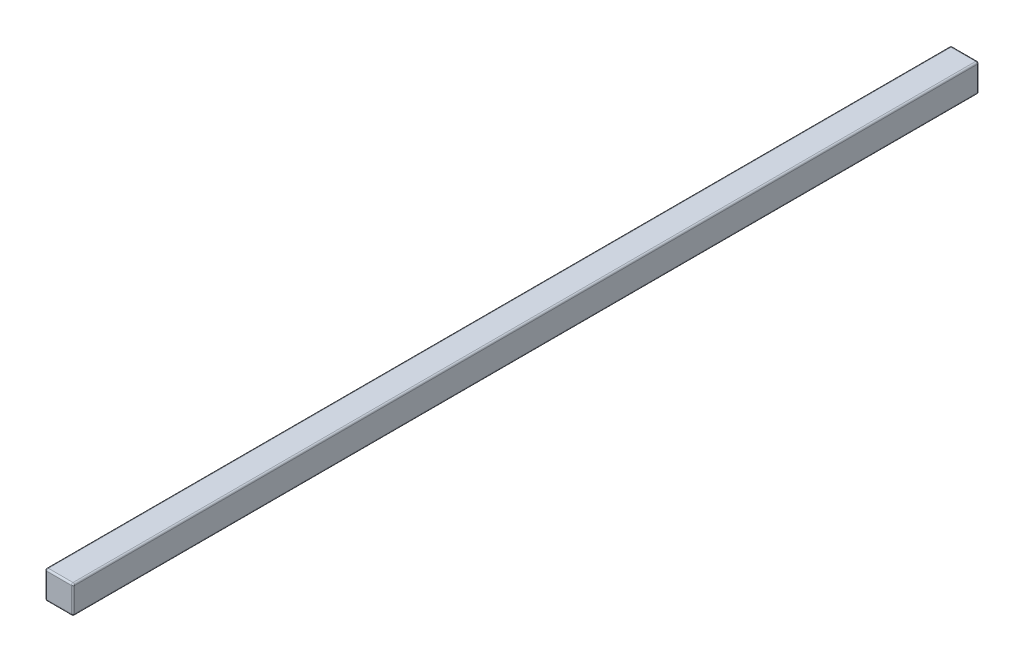
from build123d import *

# Parameters (mm, degrees)
SKETCH1_W           = 25
SKETCH1_H           = 25
BOSS_EXTRUDE1_DEPTH = 808.79
FILLET1_R           = 1.5


with BuildPart() as part:
    # Sketch1 → Boss-Extrude1 (new body)
    with BuildSketch(Plane.XY):
        Rectangle(SKETCH1_W, SKETCH1_H)
    extrude(amount=BOSS_EXTRUDE1_DEPTH)

    # Fillet1
    fillet1_edges = [part.edges().sort_by_distance(p)[0] for p in [
        (-12.5, 0, 808.79),
        (0, -12.5, 808.79),
        (12.5, 0, 808.79),
        (0, -12.5, 0),
        (-12.5, 0, 0),
        (0, 12.5, 0),
        (12.5, 0, 0),
        (0, 12.5, 808.79),
        (12.5, -12.5, 404.395),
        (-12.5, -12.5, 404.395),
        (-12.5, 12.5, 404.395),
        (12.5, 12.5, 404.395),
    ]]
    fillet(fillet1_edges, radius=FILLET1_R)


solid = part.part
